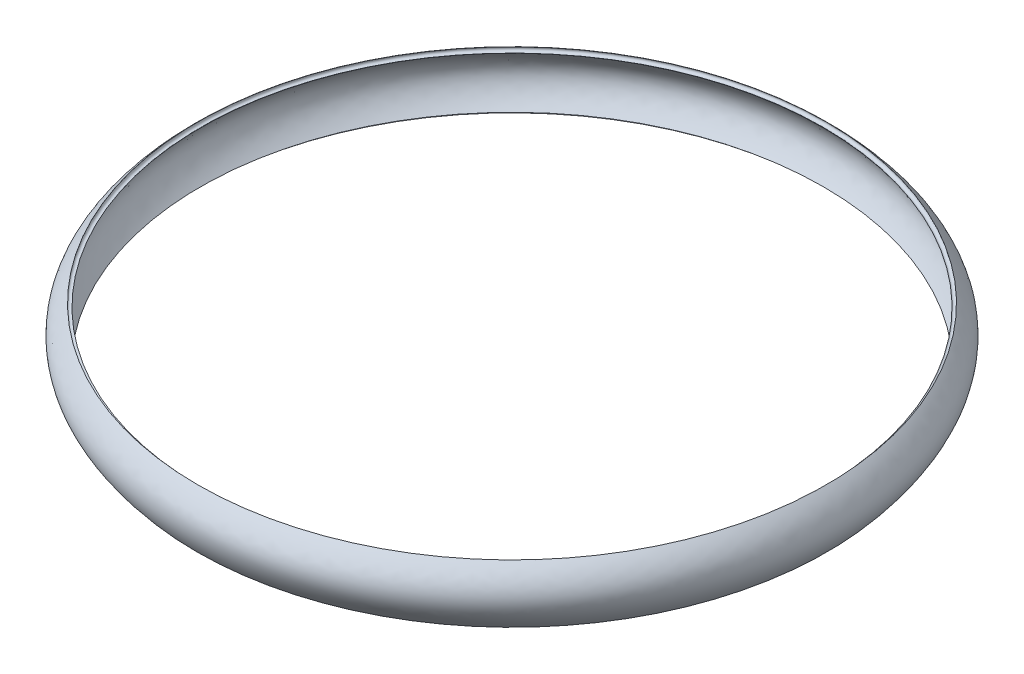
from build123d import *


with BuildPart() as part:
    # Sketch6 → Revolve3 (revolve)
    with BuildSketch(Plane.XY, mode=Mode.PRIVATE) as revolve3_sk:
        with BuildLine():
            ThreePointArc((-67.877206639, -6.18864014), (-67.820883755, -5.483780059), (-67.116023675, -5.540102943))
            add(Edge.make_bspline(
                [(-67.047072342, 5.540102943), (-67.305087109, 5.302508586), (-67.824481865, 4.794524607), (-68.657498416, 3.852610068), (-69.423665308, 2.720275242), (-69.916777092, 1.45911452), (-70.057658384, 0.241647071), (-69.871960844, -1.02285798), (-69.339061064, -2.396378628), (-68.585361992, -3.648766768), (-67.809678199, -4.702721444), (-67.34686907, -5.269161534), (-67.116023675, -5.540102943)],
                knots=[0, 0, 0, 0, 0.046756488, 0.093512976, 0.187025952, 0.280538928, 0.374051904, 0.46756488, 0.561077856, 0.654590832, 0.70134732, 0.748103808, 0.748103808, 0.748103808, 0.748103808], degree=3))
            ThreePointArc((-67.047072342, 5.540102943), (-67.753579673, 5.569212918), (-67.724469699, 6.275720249))
            add(Edge.make_bspline(
                [(-67.724469699, 6.275720249), (-72.289954114, 2.071568101), (-71.851006647, -1.524622582), (-67.877206639, -6.18864014)],
                knots=[0, 0, 0, 0, 0.748103808, 0.748103808, 0.748103808, 0.748103808], degree=3))
        make_face()
    revolve(revolve3_sk.sketch.rotate(Axis((0, 3.292455605, 0), (0, -1, 0)), 270), axis=Axis((0, 3.292455605, 0), (0, -1, 0)))


solid = part.part
